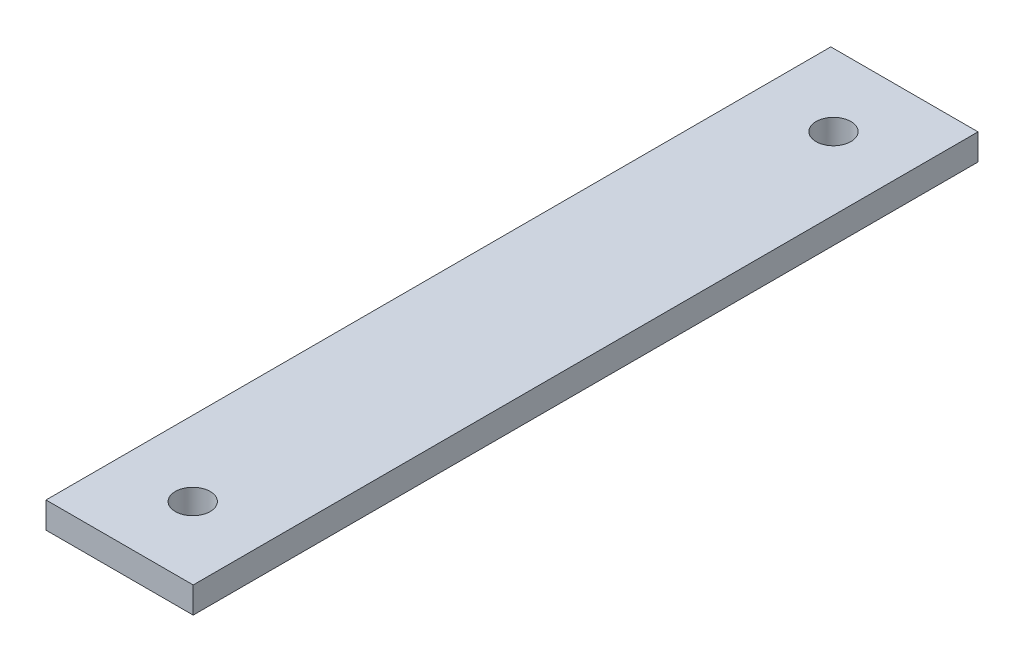
from build123d import *

# Parameters (mm, degrees)
SCHIZZO1_W                   = 8.44
SCHIZZO1_H                   = 45
ESTRUSIONE_ESTRUSIONE1_DEPTH = 1.5
SCHIZZO2_R                   = 1
TAGLIO_ESTRUSIONE1_DEPTH     = 1.5


with BuildPart() as part:
    # Schizzo1 → Estrusione-Estrusione1 (new body)
    with BuildSketch(Plane(origin=(0, 0, 0), x_dir=(1, 0, 0), z_dir=(0, 1, 0))):
        Rectangle(SCHIZZO1_W, SCHIZZO1_H)
    extrude(amount=ESTRUSIONE_ESTRUSIONE1_DEPTH)

    # Schizzo2 → Taglio-Estrusione1 (cut)
    with BuildSketch(Plane(origin=(0, 1.5, 0), x_dir=(1, 0, 0), z_dir=(0, 1, 0))):
        with Locations(Location((0.063328702, 18.37, 0), (0, 0, 270))):
            Circle(SCHIZZO2_R)
        with Locations(Location((0.063328702, -18.37, 0), (0, 0, 90))):
            Circle(SCHIZZO2_R)
    extrude(amount=-TAGLIO_ESTRUSIONE1_DEPTH, mode=Mode.SUBTRACT)


solid = part.part
